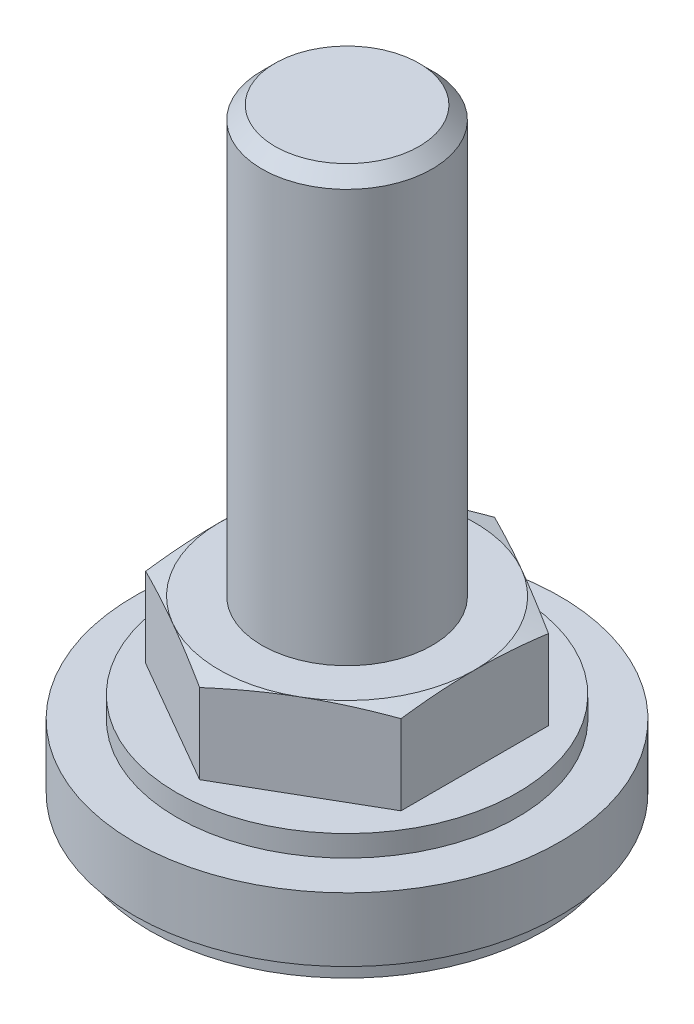
from build123d import *

# Parameters (mm, degrees)
SKETCH_2_R          = 17
CUT_EXTRUDE_1_DEPTH = 10


with BuildPart() as part:
    # 草图1 → 旋转1 (revolve)
    with BuildSketch(Plane.XY):
        Polygon((0, 50), (6.773, 50), (8, 48.773), (8, 10), (12, 10), (15, 9.196152423), (15, 2), (16, 2), (16, 0), (20, 0), (20, -6), (18.5, -6), (18.5, -8), (0, -8), align=None)
    revolve(axis=Axis((0, -8, 0), (0, 1, 0)))

    # 草图2 → 切除-拉伸1 (cut)
    with BuildSketch(Plane(origin=(0, 2, 0), x_dir=(1, 0, 0), z_dir=(0, 1, 0))):
        Circle(SKETCH_2_R)
        Polygon((-12, -6.92820323), (0, -13.856406461), (12, -6.92820323), (12, 6.92820323), (0, 13.856406461), (-12, 6.92820323), align=None, mode=Mode.SUBTRACT)
    extrude(amount=CUT_EXTRUDE_1_DEPTH, mode=Mode.SUBTRACT)


solid = part.part
